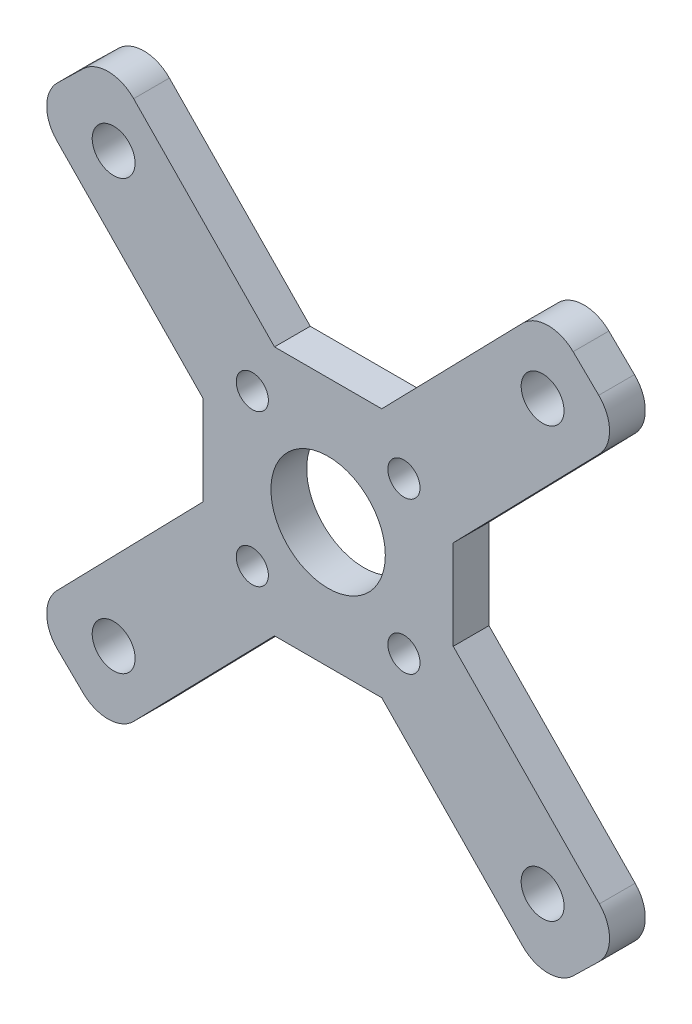
from build123d import *

# Parameters (mm, degrees)
ESQUISSE1_R        = 8
ESQUISSE1_R_2      = 2.25
BOSS_EXTRU_1_DEPTH = 5
BOSS_EXTRU_2_START = -5
ESQUISSE2_R        = 3
BOSS_EXTRU_2_DEPTH = 5


with BuildPart() as part:
    # Esquisse1 → Boss.-Extru.1 (new body)
    with BuildSketch(Plane.XY):
        with BuildLine():
            Line((7.5, -17.5), (-7.5, -17.5))
            ThreePointArc((-7.5, -17.5), (-14.571067812, -14.571067812), (-17.5, -7.5))
            Line((-17.5, -7.5), (-17.5, 7.5))
            ThreePointArc((-17.5, 7.5), (-14.571067812, 14.571067812), (-7.5, 17.5))
            Line((-7.5, 17.5), (7.5, 17.5))
            ThreePointArc((7.5, 17.5), (14.571067812, 14.571067812), (17.5, 7.5))
            Line((17.5, 7.5), (17.5, -7.5))
            ThreePointArc((17.5, -7.5), (14.571067812, -14.571067812), (7.5, -17.5))
        make_face()
        Circle(ESQUISSE1_R, mode=Mode.SUBTRACT)
        with Locations((-10.605, 10.605)):
            Circle(ESQUISSE1_R_2, mode=Mode.SUBTRACT)
        with Locations((10.605, 10.605)):
            Circle(ESQUISSE1_R_2, mode=Mode.SUBTRACT)
        with Locations((-10.605, -10.605)):
            Circle(ESQUISSE1_R_2, mode=Mode.SUBTRACT)
        with Locations((10.605, -10.605)):
            Circle(ESQUISSE1_R_2, mode=Mode.SUBTRACT)
    extrude(amount=BOSS_EXTRU_1_DEPTH)

    # Esquisse2 → Boss.-Extru.2 (add)
    # profile 1 of 4: a face of its own
    with BuildSketch(Plane.XY.offset(5).offset(BOSS_EXTRU_2_START)):
        with BuildLine():
            Line((-37.944507823, 27.247644267), (-17.5, 6.269167951))
            Line((-17.5, 6.269167951), (-17.5, 7.5))
            ThreePointArc((-17.5, 7.5), (-14.571067812, 14.571067812), (-7.5, 17.5))
            Line((-7.5, 17.5), (-27.202072783, 37.7166504))
            ThreePointArc((-27.202072783, 37.7166504), (-30.718436651, 39.22656632), (-34.272553174, 37.807793369))
            Line((-34.272553174, 37.807793369), (-37.853364854, 34.318124658))
            ThreePointArc((-37.853364854, 34.318124658), (-39.363280773, 30.80176079), (-37.944507823, 27.247644267))
        make_face()
        with Locations((-30, 30)):
            Circle(ESQUISSE2_R, mode=Mode.SUBTRACT)
    # profile 2 of 4: a face of its own
    with BuildSketch(Plane.XY.offset(5).offset(BOSS_EXTRU_2_START)):
        with BuildLine():
            ThreePointArc((37.944507823, 27.247644267), (39.363280773, 30.80176079), (37.853364854, 34.318124658))
            Line((37.853364854, 34.318124658), (34.272553174, 37.807793369))
            ThreePointArc((34.272553174, 37.807793369), (30.718436651, 39.22656632), (27.202072783, 37.7166504))
            Line((27.202072783, 37.7166504), (7.5, 17.5))
            ThreePointArc((7.5, 17.5), (14.571067812, 14.571067812), (17.5, 7.5))
            Line((17.5, 7.5), (17.5, 6.269167951))
            Line((17.5, 6.269167951), (37.944507823, 27.247644267))
        make_face()
        with Locations((30, 30)):
            Circle(ESQUISSE2_R, mode=Mode.SUBTRACT)
    # profile 3 of 4: a face of its own
    with BuildSketch(Plane.XY.offset(5).offset(BOSS_EXTRU_2_START)):
        with BuildLine():
            Line((37.944507823, -27.247644267), (17.5, -6.269167951))
            Line((17.5, -6.269167951), (17.5, -7.5))
            ThreePointArc((17.5, -7.5), (14.571067812, -14.571067812), (7.5, -17.5))
            Line((7.5, -17.5), (27.202072783, -37.7166504))
            ThreePointArc((27.202072783, -37.7166504), (30.718436651, -39.22656632), (34.272553174, -37.807793369))
            Line((34.272553174, -37.807793369), (37.853364854, -34.318124658))
            ThreePointArc((37.853364854, -34.318124658), (39.363280773, -30.80176079), (37.944507823, -27.247644267))
        make_face()
        with Locations((30, -30)):
            Circle(ESQUISSE2_R, mode=Mode.SUBTRACT)
    # profile 4 of 4: a face of its own
    with BuildSketch(Plane.XY.offset(5).offset(BOSS_EXTRU_2_START)):
        with BuildLine():
            Line((-17.5, -7.5), (-17.5, -6.269167951))
            Line((-17.5, -6.269167951), (-37.944507823, -27.247644267))
            ThreePointArc((-37.944507823, -27.247644267), (-39.363280773, -30.80176079), (-37.853364854, -34.318124658))
            Line((-37.853364854, -34.318124658), (-34.272553174, -37.807793369))
            ThreePointArc((-34.272553174, -37.807793369), (-30.718436651, -39.22656632), (-27.202072783, -37.7166504))
            Line((-27.202072783, -37.7166504), (-7.5, -17.5))
            ThreePointArc((-7.5, -17.5), (-14.571067812, -14.571067812), (-17.5, -7.5))
        make_face()
        with Locations((-30, -30)):
            Circle(ESQUISSE2_R, mode=Mode.SUBTRACT)
    extrude(amount=BOSS_EXTRU_2_DEPTH)


solid = part.part
